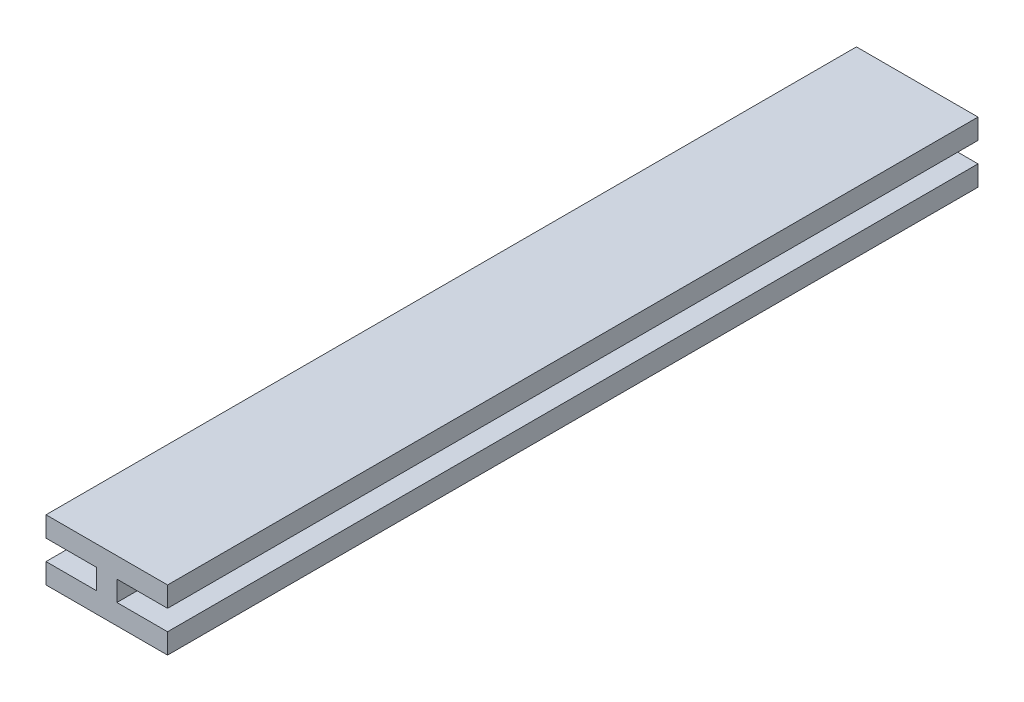
from build123d import *

# Parameters (mm, degrees)
SKETCH1_W           = 18
SKETCH1_H           = 120
BOSS_EXTRUDE2_DEPTH = 3
SKETCH4_W           = 3
SKETCH4_H           = 120
BOSS_EXTRUDE3_DEPTH = 3
SKETCH5_W           = 18
SKETCH5_H           = 120
BOSS_EXTRUDE4_DEPTH = 3


with BuildPart() as part:
    # Sketch1 → Boss-Extrude2 (new body)
    with BuildSketch(Plane(origin=(0, 0, 0), x_dir=(1, 0, 0), z_dir=(0, 1, 0))):
        Rectangle(SKETCH1_W, SKETCH1_H)
    extrude(amount=BOSS_EXTRUDE2_DEPTH)

    # Sketch4 → Boss-Extrude3 (add)
    with BuildSketch(Plane(origin=(0, 3, 0), x_dir=(1, 0, 0), z_dir=(0, 1, 0))):
        Rectangle(SKETCH4_W, SKETCH4_H)
    extrude(amount=BOSS_EXTRUDE3_DEPTH)

    # Sketch5 → Boss-Extrude4 (add)
    with BuildSketch(Plane(origin=(0, 6, 0), x_dir=(1, 0, 0), z_dir=(0, 1, 0))):
        Rectangle(SKETCH5_W, SKETCH5_H)
    extrude(amount=BOSS_EXTRUDE4_DEPTH)


solid = part.part
